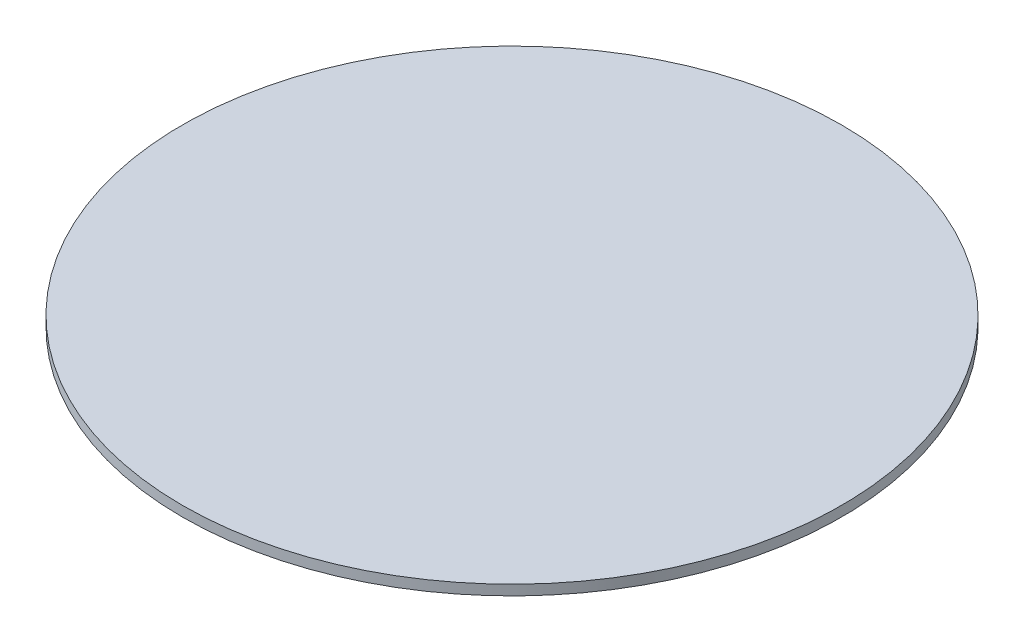
from build123d import *

# Parameters (mm, degrees)
SKETCH1_R           = 51.562
BOSS_EXTRUDE1_DEPTH = 1.59


with BuildPart() as part:
    # Sketch1 → Boss-Extrude1 (new body)
    with BuildSketch(Plane(origin=(0, 0, 0), x_dir=(1, 0, 0), z_dir=(0, 1, 0))):
        with Locations(Location((0, 0, 0), (0, 0, 90))):
            Circle(SKETCH1_R)
    extrude(amount=BOSS_EXTRUDE1_DEPTH)


solid = part.part
